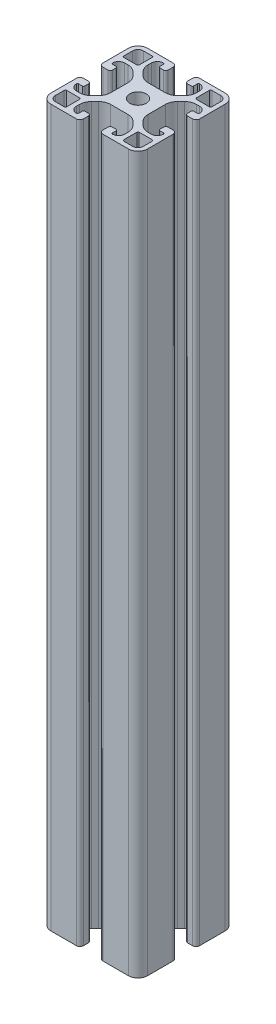
from build123d import *

# Parameters (mm, degrees)
SZKIC2_R                    = 3.4
DODANIE_WYCI_GNI_CIE2_DEPTH = 148


with BuildPart() as part:
    # Szkic2 → Dodanie-wyciągnięcie2 (new, symmetric)
    with BuildSketch(Plane(origin=(0, 0, 0), x_dir=(1, 0, 0), z_dir=(0, 1, 0))):
        with BuildLine():
            Line((-16, 20), (-5.499994708, 20))
            ThreePointArc((-5.499994708, 20), (-4.439334536, 19.560660172), (-3.999994708, 18.5))
            Line((-3.999994708, 18.5), (-3.999994708, 16.5))
            ThreePointArc((-3.999994708, 16.5), (-4.292887927, 15.792893219), (-4.999994708, 15.5))
            Line((-4.999994708, 15.5), (-6.499994708, 15.5))
            ThreePointArc((-6.499994708, 15.5), (-6.853548099, 15.646446609), (-6.999994708, 16))
            Line((-6.999994708, 16), (-6.999994708, 17.5))
            ThreePointArc((-6.999994708, 17.5), (-7.14644085, 17.853552923), (-7.499993385, 18))
            ThreePointArc((-7.499993385, 18), (-9.267764614, 17.267769292), (-10, 15.5))
            Line((-10, 15.5), (-10, 14.171067812))
            ThreePointArc((-10, 14.171067812), (-9.619397663, 12.25765065), (-8.535533906, 10.635533906))
            Line((-8.535533906, 10.635533906), (-7.114466094, 9.214466094))
            ThreePointArc((-7.114466094, 9.214466094), (-5.49234935, 8.130602337), (-3.578932188, 7.75))
            Line((-3.578932188, 7.75), (3.578932188, 7.75))
            ThreePointArc((3.578932188, 7.75), (5.49234935, 8.130602337), (7.114466094, 9.214466094))
            Line((7.114466094, 9.214466094), (8.535533906, 10.635533906))
            ThreePointArc((8.535533906, 10.635533906), (9.619397663, 12.25765065), (10, 14.171067812))
            Line((10, 14.171067812), (10, 15.5))
            ThreePointArc((10, 15.5), (9.267769292, 17.267764614), (7.500006615, 18))
            ThreePointArc((7.500006615, 18), (7.146452369, 17.853553858), (7.000005292, 17.5))
            Line((7.000005292, 17.5), (7.000005292, 16))
            ThreePointArc((7.000005292, 16), (6.853558682, 15.646446609), (6.500005292, 15.5))
            Line((6.500005292, 15.5), (5.000005292, 15.5))
            ThreePointArc((5.000005292, 15.5), (4.292898511, 15.792893219), (4.000005292, 16.5))
            Line((4.000005292, 16.5), (4.000005292, 18.5))
            ThreePointArc((4.000005292, 18.5), (4.43934512, 19.560660172), (5.500005292, 20))
            Line((5.500005292, 20), (16, 20))
            ThreePointArc((16, 20), (18.828427125, 18.828427125), (20, 16))
            Line((20, 16), (20, 5.499994708))
            ThreePointArc((20, 5.499994708), (19.560660172, 4.439334536), (18.5, 3.999994708))
            Line((18.5, 3.999994708), (16.5, 3.999994708))
            ThreePointArc((16.5, 3.999994708), (15.792893219, 4.292887927), (15.5, 4.999994708))
            Line((15.5, 4.999994708), (15.5, 6.499994708))
            ThreePointArc((15.5, 6.499994708), (15.646446609, 6.853548099), (16, 6.999994708))
            Line((16, 6.999994708), (17.5, 6.999994708))
            ThreePointArc((17.5, 6.999994708), (17.853552923, 7.14644085), (18, 7.499993385))
            ThreePointArc((18, 7.499993385), (17.267769292, 9.267764614), (15.5, 10))
            Line((15.5, 10), (14.171067812, 10))
            ThreePointArc((14.171067812, 10), (12.25765065, 9.619397663), (10.635533906, 8.535533906))
            Line((10.635533906, 8.535533906), (9.214466094, 7.114466094))
            ThreePointArc((9.214466094, 7.114466094), (8.130602337, 5.49234935), (7.75, 3.578932188))
            Line((7.75, 3.578932188), (7.75, -3.578932188))
            ThreePointArc((7.75, -3.578932188), (8.130602337, -5.49234935), (9.214466094, -7.114466094))
            Line((9.214466094, -7.114466094), (10.635533906, -8.535533906))
            ThreePointArc((10.635533906, -8.535533906), (12.25765065, -9.619397663), (14.171067812, -10))
            Line((14.171067812, -10), (15.5, -10))
            ThreePointArc((15.5, -10), (17.267764614, -9.267769292), (18, -7.500006615))
            ThreePointArc((18, -7.500006615), (17.853553858, -7.146452369), (17.5, -7.000005292))
            Line((17.5, -7.000005292), (16, -7.000005292))
            ThreePointArc((16, -7.000005292), (15.646446609, -6.853558682), (15.5, -6.500005292))
            Line((15.5, -6.500005292), (15.5, -5.000005292))
            ThreePointArc((15.5, -5.000005292), (15.792893219, -4.292898511), (16.5, -4.000005292))
            Line((16.5, -4.000005292), (18.5, -4.000005292))
            ThreePointArc((18.5, -4.000005292), (19.560660172, -4.43934512), (20, -5.500005292))
            Line((20, -5.500005292), (20, -16))
            ThreePointArc((20, -16), (18.828427125, -18.828427125), (16, -20))
            Line((16, -20), (5.499994708, -20))
            ThreePointArc((5.499994708, -20), (4.439334536, -19.560660172), (3.999994708, -18.5))
            Line((3.999994708, -18.5), (3.999994708, -16.5))
            ThreePointArc((3.999994708, -16.5), (4.292887927, -15.792893219), (4.999994708, -15.5))
            Line((4.999994708, -15.5), (6.499994708, -15.5))
            ThreePointArc((6.499994708, -15.5), (6.853548099, -15.646446609), (6.999994708, -16))
            Line((6.999994708, -16), (6.999994708, -17.5))
            ThreePointArc((6.999994708, -17.5), (7.14644085, -17.853552923), (7.499993385, -18))
            ThreePointArc((7.499993385, -18), (9.267764614, -17.267769292), (10, -15.5))
            Line((10, -15.5), (10, -14.171067812))
            ThreePointArc((10, -14.171067812), (9.619397663, -12.25765065), (8.535533906, -10.635533906))
            Line((8.535533906, -10.635533906), (7.114466094, -9.214466094))
            ThreePointArc((7.114466094, -9.214466094), (5.49234935, -8.130602337), (3.578932188, -7.75))
            Line((3.578932188, -7.75), (-3.578932188, -7.75))
            ThreePointArc((-3.578932188, -7.75), (-5.49234935, -8.130602337), (-7.114466094, -9.214466094))
            Line((-7.114466094, -9.214466094), (-8.535533906, -10.635533906))
            ThreePointArc((-8.535533906, -10.635533906), (-9.619397663, -12.25765065), (-10, -14.171067812))
            Line((-10, -14.171067812), (-10, -15.5))
            ThreePointArc((-10, -15.5), (-9.267769292, -17.267764614), (-7.500006615, -18))
            ThreePointArc((-7.500006615, -18), (-7.146452369, -17.853553858), (-7.000005292, -17.5))
            Line((-7.000005292, -17.5), (-7.000005292, -16))
            ThreePointArc((-7.000005292, -16), (-6.853558682, -15.646446609), (-6.500005292, -15.5))
            Line((-6.500005292, -15.5), (-5.000005292, -15.5))
            ThreePointArc((-5.000005292, -15.5), (-4.292898511, -15.792893219), (-4.000005292, -16.5))
            Line((-4.000005292, -16.5), (-4.000005292, -18.5))
            ThreePointArc((-4.000005292, -18.5), (-4.43934512, -19.560660172), (-5.500005292, -20))
            Line((-5.500005292, -20), (-16, -20))
            ThreePointArc((-16, -20), (-18.828427125, -18.828427125), (-20, -16))
            Line((-20, -16), (-20, -5.499994708))
            ThreePointArc((-20, -5.499994708), (-19.560660172, -4.439334536), (-18.5, -3.999994708))
            Line((-18.5, -3.999994708), (-16.5, -3.999994708))
            ThreePointArc((-16.5, -3.999994708), (-15.792893219, -4.292887927), (-15.5, -4.999994708))
            Line((-15.5, -4.999994708), (-15.5, -6.499994708))
            ThreePointArc((-15.5, -6.499994708), (-15.646446609, -6.853548099), (-16, -6.999994708))
            Line((-16, -6.999994708), (-17.5, -6.999994708))
            ThreePointArc((-17.5, -6.999994708), (-17.853552923, -7.14644085), (-18, -7.499993385))
            ThreePointArc((-18, -7.499993385), (-17.267769292, -9.267764614), (-15.5, -10))
            Line((-15.5, -10), (-14.171067812, -10))
            ThreePointArc((-14.171067812, -10), (-12.25765065, -9.619397663), (-10.635533906, -8.535533906))
            Line((-10.635533906, -8.535533906), (-9.214466094, -7.114466094))
            ThreePointArc((-9.214466094, -7.114466094), (-8.130602337, -5.49234935), (-7.75, -3.578932188))
            Line((-7.75, -3.578932188), (-7.75, 3.578932188))
            ThreePointArc((-7.75, 3.578932188), (-8.130602337, 5.49234935), (-9.214466094, 7.114466094))
            Line((-9.214466094, 7.114466094), (-10.635533906, 8.535533906))
            ThreePointArc((-10.635533906, 8.535533906), (-12.25765065, 9.619397663), (-14.171067812, 10))
            Line((-14.171067812, 10), (-15.5, 10))
            ThreePointArc((-15.5, 10), (-17.267764614, 9.267769292), (-18, 7.500006615))
            ThreePointArc((-18, 7.500006615), (-17.853553858, 7.146452369), (-17.5, 7.000005292))
            Line((-17.5, 7.000005292), (-16, 7.000005292))
            ThreePointArc((-16, 7.000005292), (-15.646446609, 6.853558682), (-15.5, 6.500005292))
            Line((-15.5, 6.500005292), (-15.5, 5.000005292))
            ThreePointArc((-15.5, 5.000005292), (-15.792893219, 4.292898511), (-16.5, 4.000005292))
            Line((-16.5, 4.000005292), (-18.5, 4.000005292))
            ThreePointArc((-18.5, 4.000005292), (-19.560660172, 4.43934512), (-20, 5.500005292))
            Line((-20, 5.500005292), (-20, 16))
            ThreePointArc((-20, 16), (-18.828427125, 18.828427125), (-16, 20))
        make_face()
        Circle(SZKIC2_R, mode=Mode.SUBTRACT)
        with BuildLine():
            Line((-11.8, -17.7), (-11.8, -12.3))
            ThreePointArc((-11.8, -12.3), (-11.946446609, -11.946446609), (-12.3, -11.8))
            Line((-12.3, -11.8), (-17.7, -11.8))
            ThreePointArc((-17.7, -11.8), (-18.053553391, -11.946446609), (-18.2, -12.3))
            Line((-18.2, -12.3), (-18.2, -16))
            ThreePointArc((-18.2, -16), (-17.555634919, -17.555634919), (-16, -18.2))
            Line((-16, -18.2), (-12.3, -18.2))
            ThreePointArc((-12.3, -18.2), (-11.946446609, -18.053553391), (-11.8, -17.7))
        make_face(mode=Mode.SUBTRACT)
        with BuildLine():
            Line((17.7, -11.8), (12.3, -11.8))
            ThreePointArc((12.3, -11.8), (11.946446609, -11.946446609), (11.8, -12.3))
            Line((11.8, -12.3), (11.8, -17.7))
            ThreePointArc((11.8, -17.7), (11.946446609, -18.053553391), (12.3, -18.2))
            Line((12.3, -18.2), (16, -18.2))
            ThreePointArc((16, -18.2), (17.555634919, -17.555634919), (18.2, -16))
            Line((18.2, -16), (18.2, -12.3))
            ThreePointArc((18.2, -12.3), (18.053553391, -11.946446609), (17.7, -11.8))
        make_face(mode=Mode.SUBTRACT)
        with BuildLine():
            Line((11.8, 17.7), (11.8, 12.3))
            ThreePointArc((11.8, 12.3), (11.946446609, 11.946446609), (12.3, 11.8))
            Line((12.3, 11.8), (17.7, 11.8))
            ThreePointArc((17.7, 11.8), (18.053553391, 11.946446609), (18.2, 12.3))
            Line((18.2, 12.3), (18.2, 16))
            ThreePointArc((18.2, 16), (17.555634919, 17.555634919), (16, 18.2))
            Line((16, 18.2), (12.3, 18.2))
            ThreePointArc((12.3, 18.2), (11.946446609, 18.053553391), (11.8, 17.7))
        make_face(mode=Mode.SUBTRACT)
        with BuildLine():
            Line((-11.8, 12.3), (-11.8, 17.7))
            ThreePointArc((-11.8, 17.7), (-11.946446609, 18.053553391), (-12.3, 18.2))
            Line((-12.3, 18.2), (-16, 18.2))
            ThreePointArc((-16, 18.2), (-17.555634919, 17.555634919), (-18.2, 16))
            Line((-18.2, 16), (-18.2, 12.3))
            ThreePointArc((-18.2, 12.3), (-18.053553391, 11.946446609), (-17.7, 11.8))
            Line((-17.7, 11.8), (-12.3, 11.8))
            ThreePointArc((-12.3, 11.8), (-11.946446609, 11.946446609), (-11.8, 12.3))
        make_face(mode=Mode.SUBTRACT)
    extrude(amount=DODANIE_WYCI_GNI_CIE2_DEPTH, both=True)


solid = part.part
